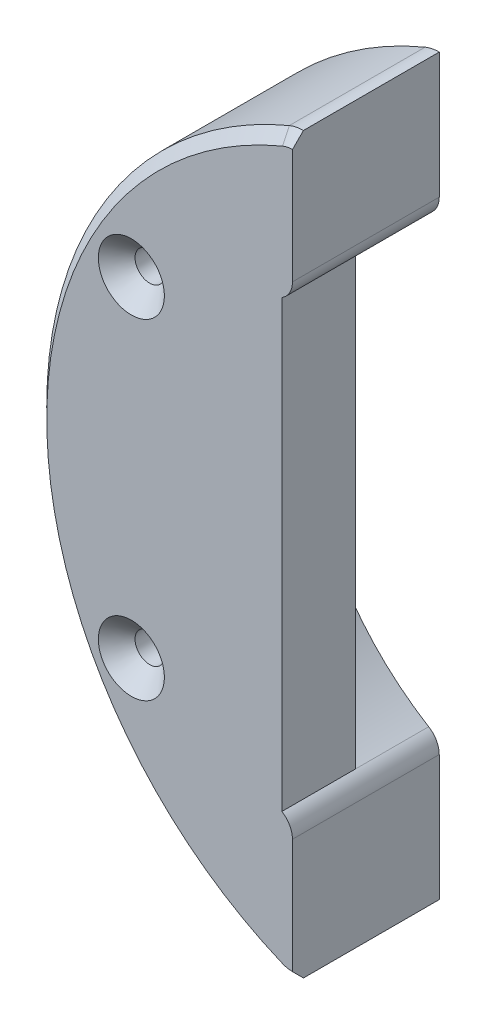
from build123d import *

# Parameters (mm, degrees)
SKETCH_1_R      = 2
EXTRUDE_1_DEPTH = 10
CHAMFER_1_SIZE  = 2.5
CHAMFER_2_SIZE  = 1.5
EXTRUDE_START   = 10
EXTRUDE_2_DEPTH = 10


with BuildPart() as part:
    # 草图1 → 凸台-拉伸1 (new, symmetric)
    with BuildSketch(Plane.XY):
        with BuildLine():
            ThreePointArc((-78.463223825, 30.320939398), (-77.40807877, 31.413717493), (-77.023496261, 32.883272305))
            Line((-77.023496261, 32.883272305), (-77.023496261, 50))
            ThreePointArc((-77.023496261, 50), (-78.005849606, 49.902548511), (-78.949910233, 49.613992762))
            ThreePointArc((-78.949910233, 49.613992762), (-112, 0), (-78.949910233, -49.613992762))
            ThreePointArc((-78.949910233, -49.613992762), (-78.005849606, -49.902548511), (-77.023496261, -50))
            Line((-77.023496261, -50), (-77.023496261, -32.883272305))
            ThreePointArc((-77.023496261, -32.883272305), (-77.40807877, -31.413717493), (-78.463223825, -30.320939398))
            ThreePointArc((-78.463223825, -30.320939398), (-95.5, 0), (-78.463223825, 30.320939398))
        make_face()
        with Locations((-98.97114317, -22.5)):
            Circle(SKETCH_1_R, mode=Mode.SUBTRACT)
        with Locations((-98.97114317, 22.5)):
            Circle(SKETCH_1_R, mode=Mode.SUBTRACT)
    extrude(amount=EXTRUDE_1_DEPTH, both=True)

    # 倒角1
    chamfer_1_edges = [part.edges().sort_by_distance(p)[0] for p in [
        (-100.97114317, -22.5, 10),
        (-100.97114317, 22.5, 10),
    ]]
    chamfer(chamfer_1_edges, length=CHAMFER_1_SIZE)

    # 倒角2
    chamfer_2_edges = [part.edges().sort_by_distance(p)[0] for p in [
        (-78.005849606, 49.902548511, 10),
        (-78.005849606, -49.902548511, 10),
        (-112, 0, 10),
    ]]
    chamfer(chamfer_2_edges, length=CHAMFER_2_SIZE)

    # 草图4 → 凸台-拉伸2 (add)
    with BuildSketch(Plane.XY.offset(EXTRUDE_START)):
        with BuildLine():
            Line((-78.463223825, -30.320939398), (-78.463223825, 30.320939398))
            ThreePointArc((-78.463223825, 30.320939398), (-95.5, 0), (-78.463223825, -30.320939398))
        make_face()
    extrude(amount=-EXTRUDE_2_DEPTH)


solid = part.part
